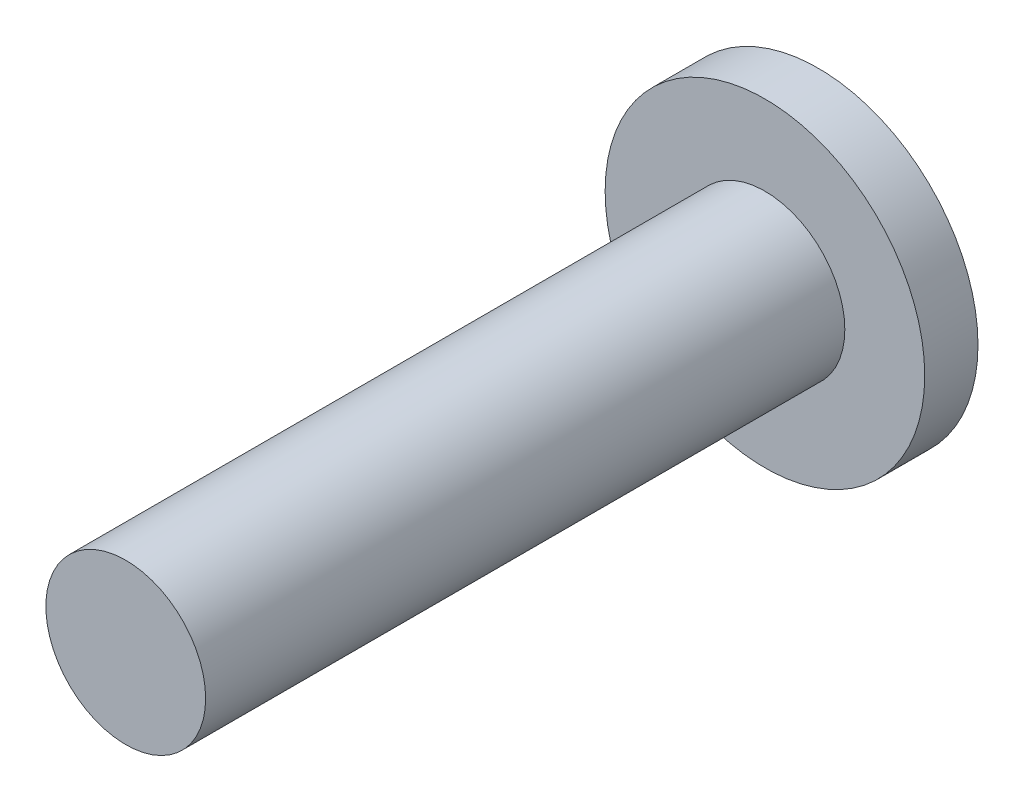
from build123d import *

# Parameters (mm, degrees)
SKETCH_1_R          = 3
EXTRUDE_1_DEPTH     = 1
CUT_EXTRUDE_1_DEPTH = 1
SKETCH_3_R          = 1.5
EXTRUDE_2_DEPTH     = 12


with BuildPart() as part:
    # 草图1 → 凸台-拉伸1 (new body)
    with BuildSketch(Plane.XY):
        Circle(SKETCH_1_R)
    extrude(amount=EXTRUDE_1_DEPTH)

    # 草图2 → 切除-拉伸1 (cut)
    with BuildSketch(Plane(origin=(0, 0, 0), x_dir=(-1, 0, 0), z_dir=(0, 0, -1))):
        Polygon((1.154700538, 0), (0.577350269, 1), (-0.577350269, 1), (-1.154700538, 0), (-0.577350269, -1), (0.577350269, -1), align=None)
    extrude(amount=-CUT_EXTRUDE_1_DEPTH, mode=Mode.SUBTRACT)

    # 草图3 → 凸台-拉伸2 (add)
    with BuildSketch(Plane.XY.offset(1)):
        Circle(SKETCH_3_R)
    extrude(amount=EXTRUDE_2_DEPTH)


solid = part.part
